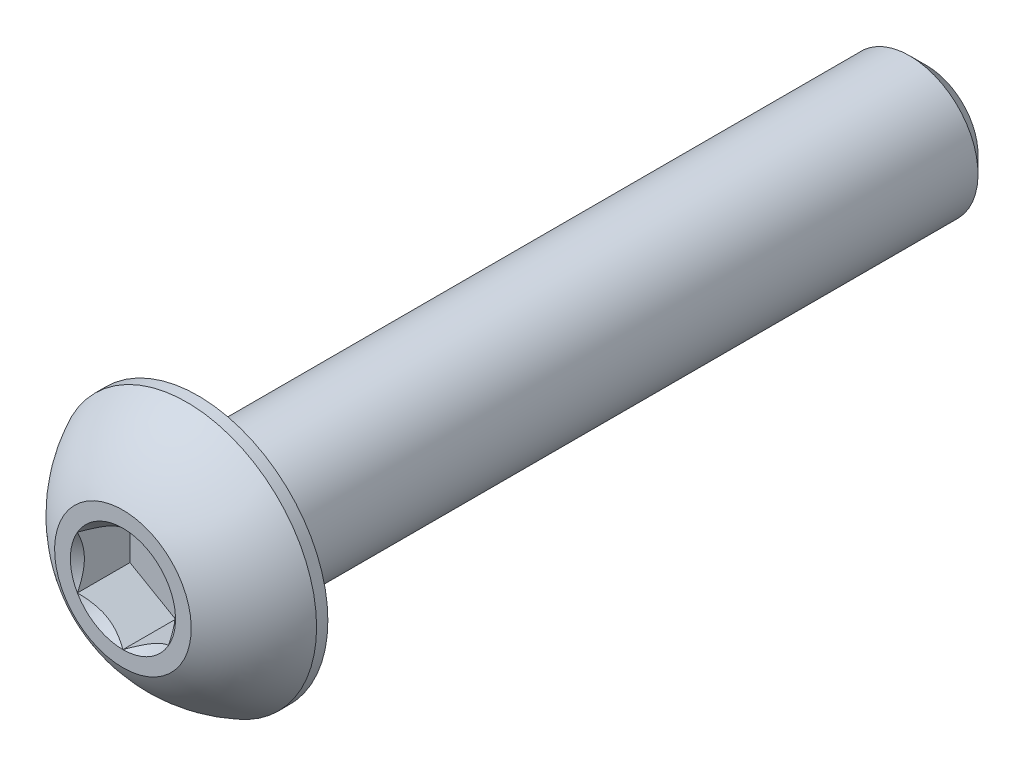
from build123d import *

# Parameters (mm, degrees)
SKETCH1_W          = 16
SKETCH1_H          = 1.5
CHAMFER1_SIZE      = 0.375
CUT_EXTRUDE2_DEPTH = 1.155


with BuildPart() as part:
    # Sketch1 → Revolve1 (revolve)
    with BuildSketch(Plane(origin=(0, 0, 0), x_dir=(0, 0, -1), z_dir=(1, 0, 0))):
        with Locations((9.65, 0.75)):
            Rectangle(SKETCH1_W, SKETCH1_H)
    revolve(axis=Axis((0, 0, -17.65), (0, 0, 1)))

    # Chamfer1
    chamfer1_edges = [part.edges().sort_by_distance(p)[0] for p in [
        (0, -1.5, -17.65),
    ]]
    chamfer(chamfer1_edges, length=CHAMFER1_SIZE)

    # Sketch7 → Revolve2 (revolve)
    with BuildSketch(Plane(origin=(0, 0, 0), x_dir=(0, 0, -1), z_dir=(1, 0, 0))):
        with BuildLine():
            Line((1.4025, 2.85), (1.65, 2.85))
            Line((1.65, 2.85), (1.65, 0))
            Line((1.65, 0), (0, 0))
            Line((0, 0), (0, 1.5))
            ThreePointArc((0, 1.5), (0.59512511, 2.285251969), (1.4025, 2.85))
        make_face()
    revolve(axis=Axis((0, 0, 0), (0, 0, -1)))

    # Sketch5 → Cut-Extrude2 (cut)
    with BuildSketch(Plane.XY):
        Polygon((1, -0.577350269), (1, 0.577350269), (0, 1.154700538), (-1, 0.577350269), (-1, -0.577350269), (0, -1.154700538), align=None)
    extrude(amount=-CUT_EXTRUDE2_DEPTH, mode=Mode.SUBTRACT)

    # Cut-Extrude3 cone 1 section (through the dimple's axis) → Cut-Extrude3 (revolve, cut)
    with BuildSketch(Plane(origin=(0, 0, 0), x_dir=(0, -1, 0), z_dir=(1, 0, 0))):
        Polygon((0, 0), (1.154700538, 0), (0, 1.154700538), align=None)
    revolve(axis=Axis((0, 0, 0), (0, 0, -1)), mode=Mode.SUBTRACT)


solid = part.part
